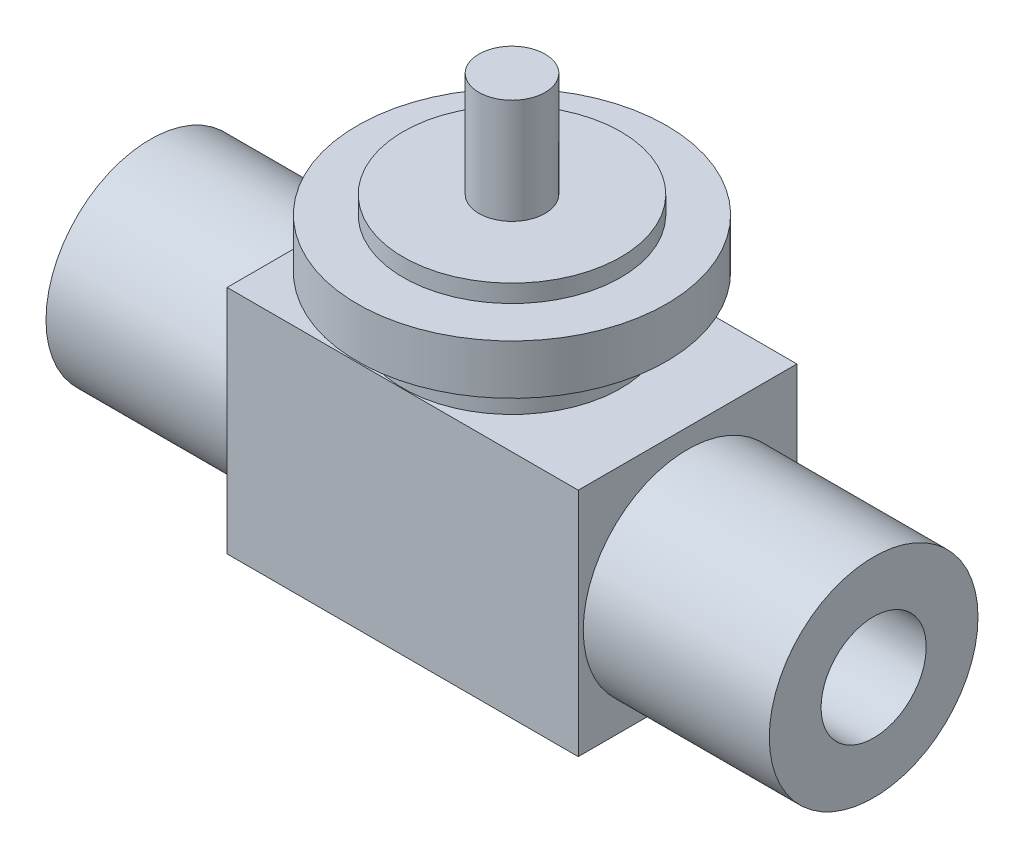
from build123d import *

# Parameters (mm, degrees)
BODY_SKETCH_W       = 31.8
BODY_SKETCH_H       = 20.9
BODY_DEPTH          = 9.9
NUT_X_SKETCH_W      = 16.85
NUT_X_SKETCH_H      = 9.45
NUT_X_SKETCH_2_W    = 16.85
NUT_X_SKETCH_2_H    = 9.45
SOCKET_X_SKETCH_W   = 17.8
SOCKET_X_SKETCH_H   = 4.7625
SOCKET_X_SKETCH_2_W = 17.8
SOCKET_X_SKETCH_2_H = 4.7625


with BuildPart() as part:
    # Body Sketch → Body (new, symmetric)
    with BuildSketch(Plane.XY):
        with Locations((0, 0.75)):
            Rectangle(BODY_SKETCH_W, BODY_SKETCH_H)
    extrude(amount=BODY_DEPTH, both=True)

    # Nut _X Sketch → Nut _X (revolve)
    with BuildSketch(Plane.XY):
        with Locations((24.325, 4.725)):
            Rectangle(NUT_X_SKETCH_W, NUT_X_SKETCH_H)
    revolve(axis=Axis((-1000, 0, 0), (1, 0, 0)))

    # Nut -X Sketch 2 → Nut -X 2 (revolve)
    with BuildSketch(Plane.XY):
        with Locations((-24.325, 4.725)):
            Rectangle(NUT_X_SKETCH_2_W, NUT_X_SKETCH_2_H)
    revolve(axis=Axis((-1000, 0, 0), (1, 0, 0)))

    # Socket _X Sketch → Socket _X (revolve, cut)
    with BuildSketch(Plane.XY):
        with Locations((24.85, 2.38125)):
            Rectangle(SOCKET_X_SKETCH_W, SOCKET_X_SKETCH_H)
    revolve(axis=Axis((-1000, 0, 0), (1, 0, 0)), mode=Mode.SUBTRACT)

    # Socket -X Sketch 2 → Socket -X 2 (revolve, cut)
    with BuildSketch(Plane.XY):
        with Locations((-24.85, 2.38125)):
            Rectangle(SOCKET_X_SKETCH_2_W, SOCKET_X_SKETCH_2_H)
    revolve(axis=Axis((-1000, 0, 0), (1, 0, 0)), mode=Mode.SUBTRACT)

    # Stem Sketch → Stem (revolve)
    with BuildSketch(Plane.XY):
        Polygon((0, 11.2), (9.85, 11.2), (9.85, 15.4), (14, 15.4), (14, 19.9), (9.85, 19.9), (9.85, 21.5), (3, 21.5), (3, 31), (0, 31), align=None)
    revolve(axis=Axis((0, -500, 0), (0, 1, 0)))


solid = part.part
